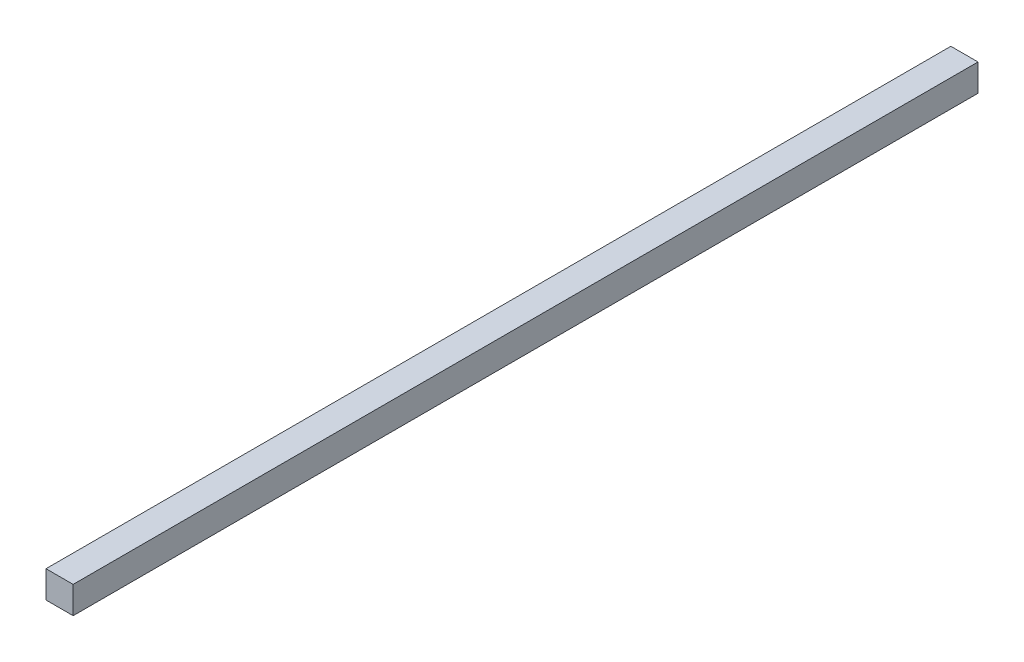
from build123d import *

# Parameters (mm, degrees)
SKETCH_1_W      = 30
SKETCH_1_H      = 30
EXTRUDE_1_DEPTH = 1000


with BuildPart() as part:
    # 草图1 → 凸台-拉伸1 (new body)
    with BuildSketch(Plane.XY):
        Rectangle(SKETCH_1_W, SKETCH_1_H)
    extrude(amount=EXTRUDE_1_DEPTH)


solid = part.part
